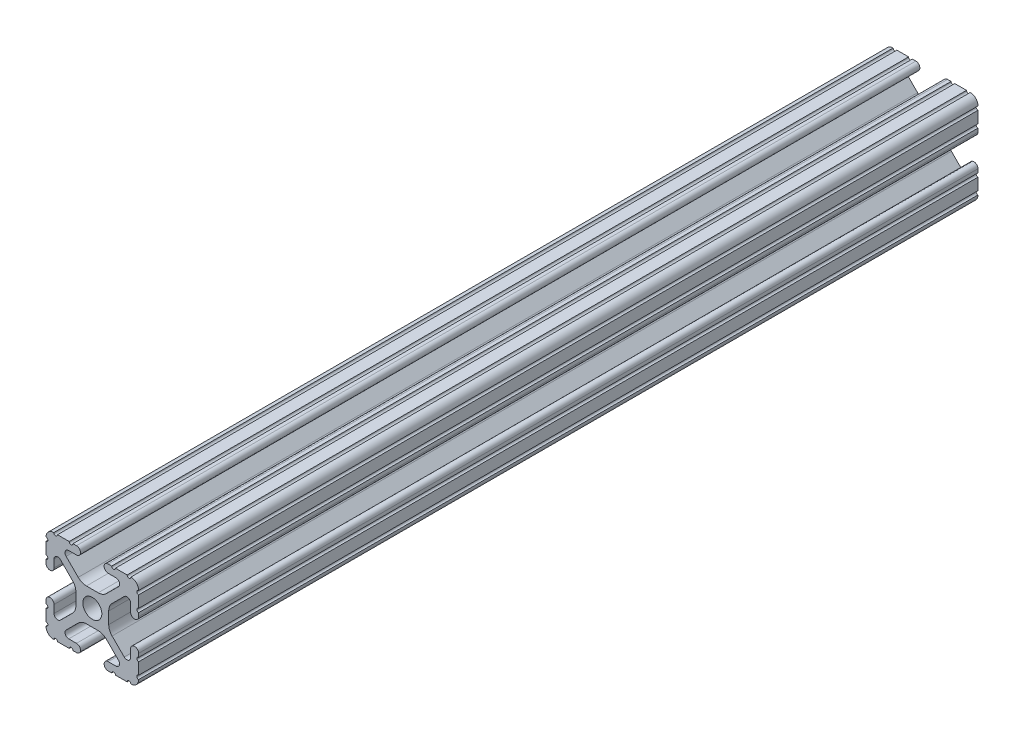
from build123d import *

# Parameters (mm, degrees)
SKETCH1_R           = 2.6035
BOSS_EXTRUDE1_DEPTH = 230.1875


with BuildPart() as part:
    # Sketch1 → Boss-Extrude1 (new body)
    with BuildSketch(Plane(origin=(0, 0, -25.4), x_dir=(-1, 0, 0), z_dir=(0, 0, -1))):
        with BuildLine():
            Line((12.7, -9.5504), (12.7, -6.3330836))
            ThreePointArc((12.7, -6.3330836), (12.192, -5.8250836), (12.7, -5.3170836))
            Line((12.7, -5.3170836), (12.7, -4.3434))
            ThreePointArc((12.7, -4.3434), (11.5951, -3.2385), (10.4902, -4.3434))
            Line((10.4902, -4.3434), (10.4902, -6.474794456))
            ThreePointArc((10.4902, -6.474794456), (9.863006367, -7.413456061), (8.75577951, -7.193214945))
            Line((8.75577951, -7.193214945), (5.42573597, -3.863171405))
            ThreePointArc((5.42573597, -3.863171405), (4.737482484, -2.833127272), (4.4958, -1.618107374))
            Line((4.4958, -1.618107374), (4.4958, 1.618107374))
            ThreePointArc((4.4958, 1.618107374), (4.737482484, 2.833127272), (5.42573597, 3.863171405))
            Line((5.42573597, 3.863171405), (8.75577951, 7.193214945))
            ThreePointArc((8.75577951, 7.193214945), (9.863006367, 7.413456061), (10.4902, 6.474794456))
            Line((10.4902, 6.474794456), (10.4902, 4.343399971))
            ThreePointArc((10.4902, 4.343399971), (11.5951, 3.238499971), (12.7, 4.343399971))
            Line((12.7, 4.343399971), (12.7, 5.3170836))
            ThreePointArc((12.7, 5.3170836), (12.192, 5.8250836), (12.7, 6.3330836))
            Line((12.7, 6.3330836), (12.7, 9.5504))
            ThreePointArc((12.7, 9.5504), (12.192000006, 10.058323491), (12.699846982, 10.566399977))
            ThreePointArc((12.699846982, 10.566399977), (12.082522516, 12.082522516), (10.566399977, 12.699846982))
            ThreePointArc((10.566399977, 12.699846982), (10.058323491, 12.192000006), (9.5504, 12.7))
            Line((9.5504, 12.7), (6.3330836, 12.7))
            ThreePointArc((6.3330836, 12.7), (5.8250836, 12.192), (5.3170836, 12.7))
            Line((5.3170836, 12.7), (4.3434, 12.7))
            ThreePointArc((4.3434, 12.7), (3.2385, 11.5951), (4.3434, 10.4902))
            Line((4.3434, 10.4902), (6.474794456, 10.4902))
            ThreePointArc((6.474794456, 10.4902), (7.413456061, 9.863006367), (7.193214945, 8.75577951))
            Line((7.193214945, 8.75577951), (3.863171405, 5.42573597))
            ThreePointArc((3.863171405, 5.42573597), (2.833127272, 4.737482484), (1.618107374, 4.4958))
            Line((1.618107374, 4.4958), (-1.618107374, 4.4958))
            ThreePointArc((-1.618107374, 4.4958), (-2.833127272, 4.737482484), (-3.863171405, 5.42573597))
            Line((-3.863171405, 5.42573597), (-7.193214945, 8.75577951))
            ThreePointArc((-7.193214945, 8.75577951), (-7.413456061, 9.863006367), (-6.474794456, 10.4902))
            Line((-6.474794456, 10.4902), (-4.343399971, 10.4902))
            ThreePointArc((-4.343399971, 10.4902), (-3.238499971, 11.5951), (-4.343399971, 12.7))
            Line((-4.343399971, 12.7), (-5.3170836, 12.7))
            ThreePointArc((-5.3170836, 12.7), (-5.8250836, 12.192), (-6.3330836, 12.7))
            Line((-6.3330836, 12.7), (-9.5504, 12.7))
            ThreePointArc((-9.5504, 12.7), (-10.058323491, 12.192000006), (-10.566399977, 12.699846982))
            ThreePointArc((-10.566399977, 12.699846982), (-12.082522516, 12.082522516), (-12.699846982, 10.566399977))
            ThreePointArc((-12.699846982, 10.566399977), (-12.192000006, 10.058323491), (-12.7, 9.5504))
            Line((-12.7, 9.5504), (-12.7, 6.3330836))
            ThreePointArc((-12.7, 6.3330836), (-12.192, 5.8250836), (-12.7, 5.3170836))
            Line((-12.7, 5.3170836), (-12.7, 4.3434))
            ThreePointArc((-12.7, 4.3434), (-11.5951, 3.2385), (-10.4902, 4.3434))
            Line((-10.4902, 4.3434), (-10.4902, 6.474794456))
            ThreePointArc((-10.4902, 6.474794456), (-9.863006367, 7.413456061), (-8.75577951, 7.193214945))
            Line((-8.75577951, 7.193214945), (-5.42573597, 3.863171405))
            ThreePointArc((-5.42573597, 3.863171405), (-4.737482484, 2.833127272), (-4.4958, 1.618107374))
            Line((-4.4958, 1.618107374), (-4.4958, -1.618107374))
            ThreePointArc((-4.4958, -1.618107374), (-4.737482484, -2.833127272), (-5.42573597, -3.863171405))
            Line((-5.42573597, -3.863171405), (-8.75577951, -7.193214945))
            ThreePointArc((-8.75577951, -7.193214945), (-9.863006367, -7.413456061), (-10.4902, -6.474794456))
            Line((-10.4902, -6.474794456), (-10.4902, -4.343399971))
            ThreePointArc((-10.4902, -4.343399971), (-11.5951, -3.238499971), (-12.7, -4.343399971))
            Line((-12.7, -4.343399971), (-12.7, -5.3170836))
            ThreePointArc((-12.7, -5.3170836), (-12.192, -5.8250836), (-12.7, -6.3330836))
            Line((-12.7, -6.3330836), (-12.7, -9.5504))
            ThreePointArc((-12.7, -9.5504), (-12.192000006, -10.058323491), (-12.699846982, -10.566399977))
            ThreePointArc((-12.699846982, -10.566399977), (-12.082522516, -12.082522516), (-10.566399977, -12.699846982))
            ThreePointArc((-10.566399977, -12.699846982), (-10.058323491, -12.192000006), (-9.5504, -12.7))
            Line((-9.5504, -12.7), (-6.3330836, -12.7))
            ThreePointArc((-6.3330836, -12.7), (-5.8250836, -12.192), (-5.3170836, -12.7))
            Line((-5.3170836, -12.7), (-4.3434, -12.7))
            ThreePointArc((-4.3434, -12.7), (-3.2385, -11.5951), (-4.3434, -10.4902))
            Line((-4.3434, -10.4902), (-6.474794456, -10.4902))
            ThreePointArc((-6.474794456, -10.4902), (-7.413456061, -9.863006367), (-7.193214945, -8.75577951))
            Line((-7.193214945, -8.75577951), (-3.863171405, -5.42573597))
            ThreePointArc((-3.863171405, -5.42573597), (-2.833127272, -4.737482484), (-1.618107374, -4.4958))
            Line((-1.618107374, -4.4958), (1.618107374, -4.4958))
            ThreePointArc((1.618107374, -4.4958), (2.833127272, -4.737482484), (3.863171405, -5.42573597))
            Line((3.863171405, -5.42573597), (7.193214945, -8.75577951))
            ThreePointArc((7.193214945, -8.75577951), (7.413456061, -9.863006367), (6.474794456, -10.4902))
            Line((6.474794456, -10.4902), (4.343399971, -10.4902))
            ThreePointArc((4.343399971, -10.4902), (3.238499971, -11.5951), (4.343399971, -12.7))
            Line((4.343399971, -12.7), (5.3170836, -12.7))
            ThreePointArc((5.3170836, -12.7), (5.8250836, -12.192), (6.3330836, -12.7))
            Line((6.3330836, -12.7), (9.5504, -12.7))
            ThreePointArc((9.5504, -12.7), (10.058323491, -12.192000006), (10.566399977, -12.699846982))
            ThreePointArc((10.566399977, -12.699846982), (12.082522516, -12.082522516), (12.699846982, -10.566399977))
            ThreePointArc((12.699846982, -10.566399977), (12.192000006, -10.058323491), (12.7, -9.5504))
        make_face()
        with Locations(Location((0, 0, 0), (0, 0, 180))):
            Circle(SKETCH1_R, mode=Mode.SUBTRACT)
    extrude(amount=BOSS_EXTRUDE1_DEPTH)


solid = part.part
